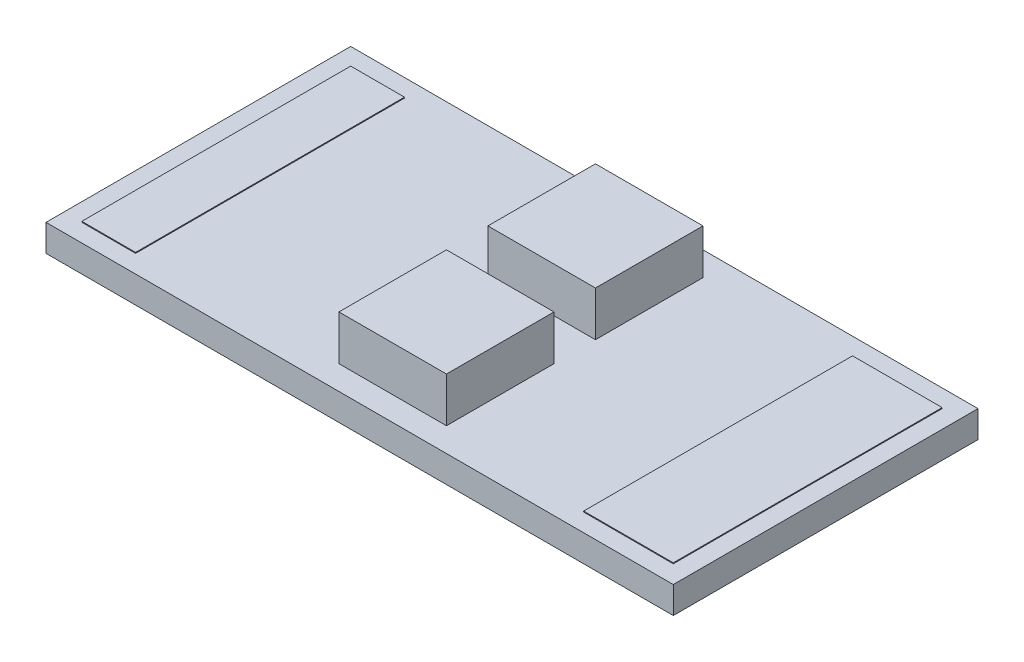
from build123d import *

# Parameters (mm, degrees)
SKETCH_1_W      = 35
SKETCH_1_H      = 17
EXTRUDE_1_DEPTH = 1.5
SKETCH_4_W      = 6
SKETCH_4_H      = 6
EXTRUDE_3_DEPTH = 4
SKETCH_6_W      = 5
SKETCH_6_H      = 15
SKETCH_6_W_2    = 3
EXTRUDE_4_DEPTH = 1.55


with BuildPart() as part:
    # Эскиз1 → Бобышка-Вытянуть1 (new body)
    with BuildSketch(Plane(origin=(0, 0, 0), x_dir=(1, 0, 0), z_dir=(0, 1, 0))):
        with Locations((-17.5, 0)):
            Rectangle(SKETCH_1_W, SKETCH_1_H)
    extrude(amount=EXTRUDE_1_DEPTH)

    # Эскиз4 → Бобышка-Вытянуть3 (add)
    with BuildSketch(Plane(origin=(0, 0, 0), x_dir=(1, 0, 0), z_dir=(0, 1, 0))):
        with Locations((-17, 4.156615609)):
            Rectangle(SKETCH_4_W, SKETCH_4_H)
        with Locations((-17, -4.156615609)):
            Rectangle(SKETCH_4_W, SKETCH_4_H)
    extrude(amount=EXTRUDE_3_DEPTH)

    # Эскиз6 → Бобышка-Вытянуть4 (add)
    with BuildSketch(Plane(origin=(0, 0, 0), x_dir=(1, 0, 0), z_dir=(0, 1, 0))):
        with Locations((-3.5, 0)):
            Rectangle(SKETCH_6_W, SKETCH_6_H)
        with Locations((-32.5, 0)):
            Rectangle(SKETCH_6_W_2, SKETCH_6_H)
    extrude(amount=EXTRUDE_4_DEPTH)


solid = part.part
